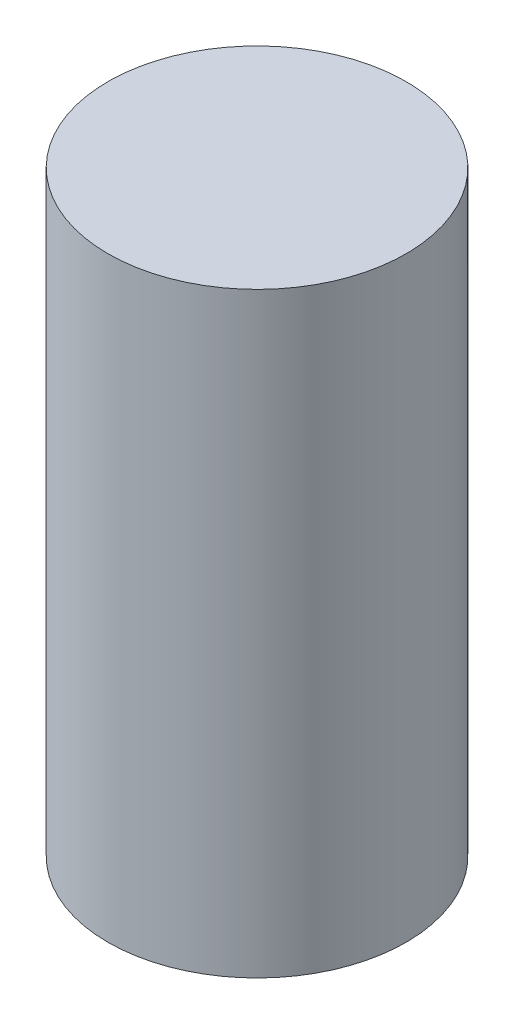
from build123d import *

# Parameters (mm, degrees)
SKETCH_1_R      = 15
EXTRUDE_1_DEPTH = 60


with BuildPart() as part:
    # 草图1 → 凸台-拉伸1 (new body)
    with BuildSketch(Plane(origin=(0, 0, 0), x_dir=(1, 0, 0), z_dir=(0, 1, 0))):
        with Locations(Location((0, 0, 0), (0, 0, 270))):
            Circle(SKETCH_1_R)
    extrude(amount=EXTRUDE_1_DEPTH)


solid = part.part
